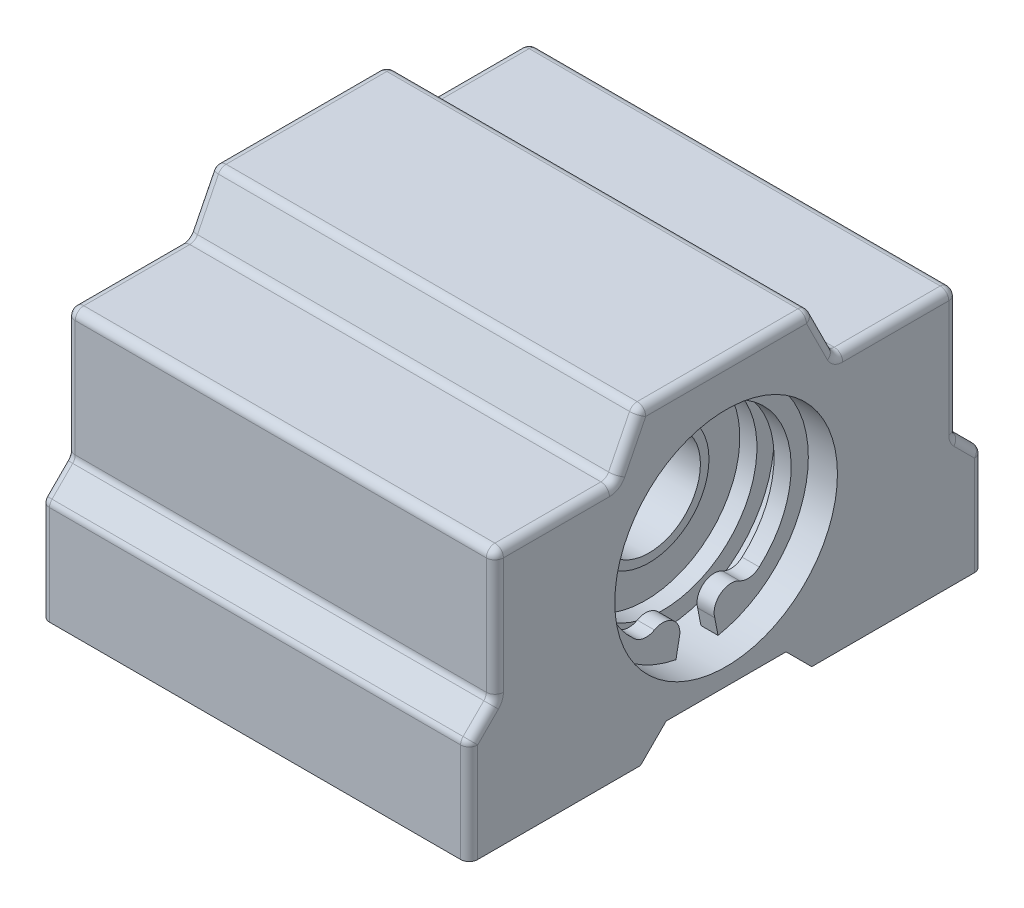
from build123d import *

# Parameters (mm, degrees)
SKETCH1_R           = 6.5
BOSS_EXTRUDE1_DEPTH = 25
EXTRUDE_THIN1_START = 0.5
SKETCH1_4_R         = 3.5
SKETCH1_4_R_2       = 3
EXTRUDE_THIN1_DEPTH = 20
BOSS_EXTRUDE2_START = 0.8
SKETCH1_5_R         = 5.5
SKETCH1_5_R_2       = 3
BOSS_EXTRUDE2_DEPTH = 19.5
BOSS_EXTRUDE3_START = 0.3
SKETCH1_6_R         = 6.5
SKETCH1_6_R_2       = 5.5
BOSS_EXTRUDE3_DEPTH = 21
BOSS_EXTRUDE4_START = 1
BOSS_EXTRUDE4_DEPTH = 1
FILLET1_R           = 0.5


with BuildPart() as part:
    # Sketch1 → Boss-Extrude1 (new body)
    with BuildSketch(Plane(origin=(0, 0, 0), x_dir=(0, 0, -1), z_dir=(1, 0, 0))):
        Polygon((-15, -9), (-5, -9), (-3.5, -7.5), (3.5, -7.5), (5, -9), (15, -9), (15, -3), (13.5, -1.5), (13.5, 6), (6.5, 6), (5, 9), (-5, 9), (-6.5, 6), (-13.5, 6), (-13.5, -1.5), (-15, -3), align=None)
        Circle(SKETCH1_R, mode=Mode.SUBTRACT)
    extrude(amount=BOSS_EXTRUDE1_DEPTH)



with BuildPart() as body_2:
    # Sketch1<4> → Extrude-Thin1 (new body)
    with BuildSketch(Plane(origin=(0, 0, 0), x_dir=(0, 0, -1), z_dir=(1, 0, 0)).offset(EXTRUDE_THIN1_START)):
        Circle(SKETCH1_4_R)
        Circle(SKETCH1_4_R_2, mode=Mode.SUBTRACT)
    extrude(amount=EXTRUDE_THIN1_DEPTH)

    # Sketch1<5> → Boss-Extrude2 (add)
    with BuildSketch(Plane(origin=(0, 0, 0), x_dir=(0, 0, -1), z_dir=(1, 0, 0)).offset(BOSS_EXTRUDE2_START)):
        Circle(SKETCH1_5_R)
        Circle(SKETCH1_5_R_2, mode=Mode.SUBTRACT)
    extrude(amount=BOSS_EXTRUDE2_DEPTH)


with BuildPart() as part_1:
    add(part.part)

    add(body_2.part)  # Boss-Extrude3 merges body 2
    # Sketch1<6> → Boss-Extrude3 (add)
    with BuildSketch(Plane(origin=(0, 0, 0), x_dir=(0, 0, -1), z_dir=(1, 0, 0)).offset(BOSS_EXTRUDE3_START)):
        Circle(SKETCH1_6_R)
        Circle(SKETCH1_6_R_2, mode=Mode.SUBTRACT)
    extrude(amount=BOSS_EXTRUDE3_DEPTH)

    # Sketch3 → Boss-Extrude4 (add)
    with BuildSketch(Plane(origin=(21.3, 0, 0), x_dir=(0, 0, -1), z_dir=(1, 0, 0)).offset(BOSS_EXTRUDE4_START)):
        with BuildLine():
            Line((-1.039258499, -5.400920456), (-1.22821459, -6.382905993))
            ThreePointArc((-1.22821459, -6.382905993), (0, 6.5), (1.22821459, -6.382905993))
            Line((1.22821459, -6.382905993), (1.039258499, -5.400920456))
            ThreePointArc((1.039258499, -5.400920456), (1.377808725, -4.340610122), (2.487175706, -4.250171409))
            ThreePointArc((2.487175706, -4.250171409), (3.080776399, -4.371188169), (3.635318393, -4.12728242))
            ThreePointArc((3.635318393, -4.12728242), (0, 5.5), (-3.635318393, -4.12728242))
            ThreePointArc((-3.635318393, -4.12728242), (-3.080776399, -4.371188169), (-2.487175706, -4.250171409))
            ThreePointArc((-2.487175706, -4.250171409), (-1.377808725, -4.340610122), (-1.039258499, -5.400920456))
        make_face()
    extrude(amount=BOSS_EXTRUDE4_DEPTH)

    # Fillet1
    fillet1_edges = [part_1.edges().sort_by_distance(p)[0] for p in [
        (12.5, -1.5, -13.5),
        (12.5, -1.5, 13.5),
        (12.5, -3, 15),
        (12.5, -3, -15),
        (12.5, 6, -6.5),
        (12.5, 6, 6.5),
        (12.5, 9, 5),
        (12.5, 9, -5),
        (12.5, 6, -13.5),
        (12.5, 6, 13.5),
        (25, 7.5, -5.75),
        (25, 7.5, 5.75),
        (25, 2.25, 13.5),
        (0, -2.25, 14.25),
        (0, 7.5, 5.75),
        (25, -2.25, -14.25),
        (25, -6, -15),
        (25, 2.25, -13.5),
        (25, 9, 0),
        (25, 6, -10),
        (25, 6, 10),
        (25, -2.25, 14.25),
        (25, -6, 15),
        (0, -6, -15),
        (0, -2.25, -14.25),
        (0, 2.25, -13.5),
        (0, 7.5, -5.75),
        (0, 6, -10),
        (0, 9, 0),
        (0, -6, 15),
        (0, 2.25, 13.5),
        (0, 6, 10),
    ]]
    fillet(fillet1_edges, radius=FILLET1_R)


solid = part_1.part
